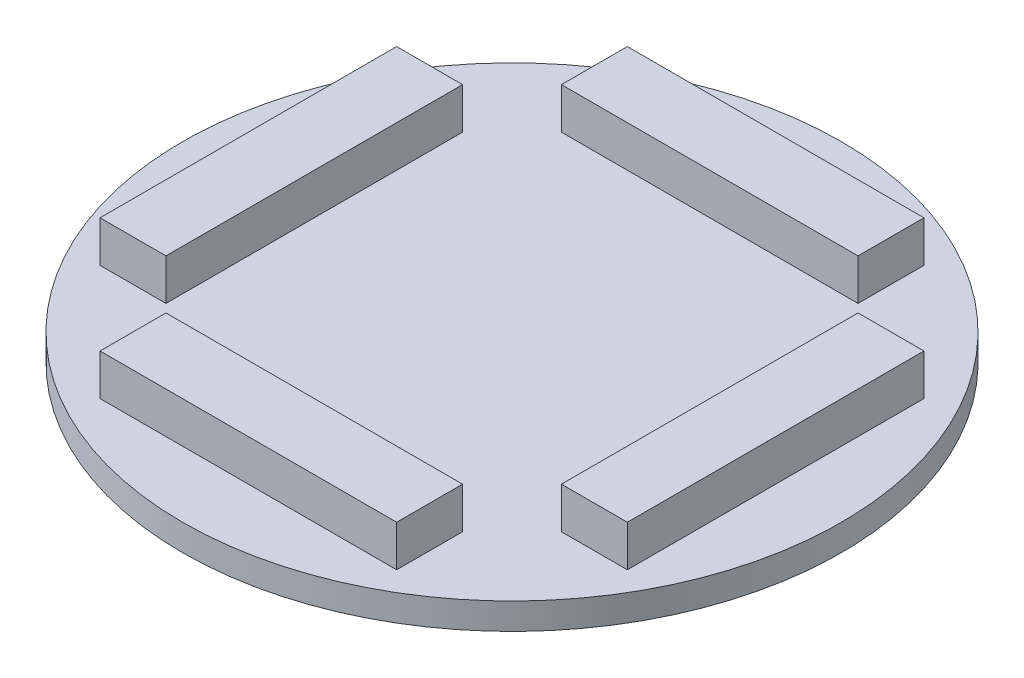
from build123d import *

# Parameters (mm, degrees)
SKETCH1_R                    = 20
PCB_DEPTH                    = 1.6
SKETCH2_W                    = 18
SKETCH2_H                    = 4
HIROSE_CONNECTOR_STACK_DEPTH = 2.5
CIRPATTERN1_COUNT            = 4


with BuildPart() as part:
    # Sketch1 → PCB (new body)
    with BuildSketch(Plane(origin=(0, 0, 0), x_dir=(1, 0, 0), z_dir=(0, 1, 0))):
        with Locations(Location((0, 0, 0), (0, 0, 270))):
            Circle(SKETCH1_R)
    extrude(amount=PCB_DEPTH)

    # Sketch2 → Hirose Connector Stack (add)
    with BuildSketch(Plane(origin=(0, 1.6, 0), x_dir=(1, 0, 0), z_dir=(0, 1, 0))):
        with Locations((0, 14)):
            Rectangle(SKETCH2_W, SKETCH2_H)
    hirose_connector_stack = extrude(amount=HIROSE_CONNECTOR_STACK_DEPTH)

    # CirPattern1: Hirose Connector Stack ×4 about axis
    cirpattern1_axis = Axis((0, 0, 0), (0, 1, 0))
    for i in range(1, CIRPATTERN1_COUNT):
        add(hirose_connector_stack.rotate(cirpattern1_axis, i * 360 / CIRPATTERN1_COUNT))


solid = part.part
